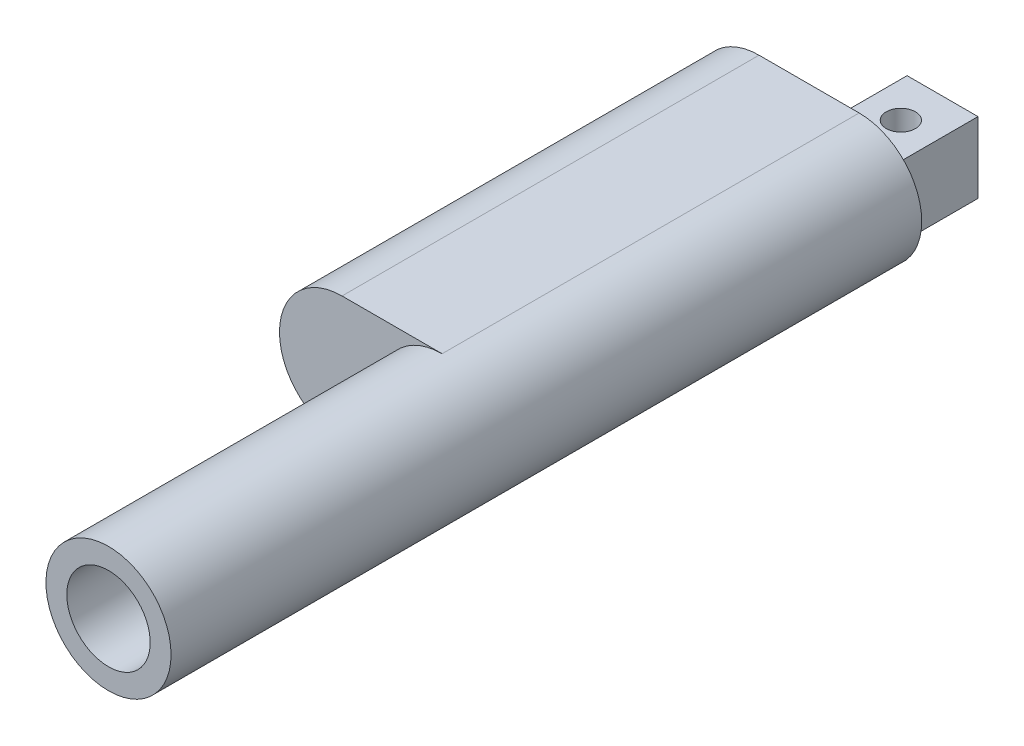
from build123d import *

# Parameters (mm, degrees)
ESQUISSE1_R             = 15
ESQUISSE1_R_2           = 10
BOSS_EXTRU_1_DEPTH      = 180
BOSS_EXTRU_2_DEPTH      = 100
ESQUISSE3_W             = 17
ESQUISSE3_H             = 17
BOSS_EXTRU_3_DEPTH      = 20
ESQUISSE4_R             = 3.5
ENL_V_MAT_EXTRU_1_DEPTH = 20


with BuildPart() as part:
    # Esquisse1 → Boss.-Extru.1 (new body)
    with BuildSketch(Plane.XY):
        with Locations(Location((0, 0, 0), (0, 0, 180))):
            Circle(ESQUISSE1_R)
        with Locations(Location((0, 0, 0), (0, 0, 180))):
            Circle(ESQUISSE1_R_2, mode=Mode.SUBTRACT)
    extrude(amount=BOSS_EXTRU_1_DEPTH)

    # Esquisse2 → Boss.-Extru.2 (add)
    with BuildSketch(Plane(origin=(0, 0, 0), x_dir=(-1, 0, 0), z_dir=(0, 0, -1))):
        with BuildLine():
            Line((0, 15), (24, 15))
            ThreePointArc((24, 15), (39, 0), (24, -15))
            Line((24, -15), (0, -15))
            ThreePointArc((0, -15), (-15, 0), (0, 15))
        make_face()
    extrude(amount=-BOSS_EXTRU_2_DEPTH)

    # Esquisse3 → Boss.-Extru.3 (add)
    with BuildSketch(Plane(origin=(0, 0, 0), x_dir=(-1, 0, 0), z_dir=(0, 0, -1))):
        Rectangle(ESQUISSE3_W, ESQUISSE3_H)
    extrude(amount=BOSS_EXTRU_3_DEPTH)

    # Esquisse4 → Enlèv. mat.-Extru.1 (cut)
    with BuildSketch(Plane(origin=(0, 8.5, 0), x_dir=(1, 0, 0), z_dir=(0, 1, 0))):
        with Locations(Location((0, 10, 0), (0, 0, 180))):
            Circle(ESQUISSE4_R)
    extrude(amount=-ENL_V_MAT_EXTRU_1_DEPTH, mode=Mode.SUBTRACT)


solid = part.part
